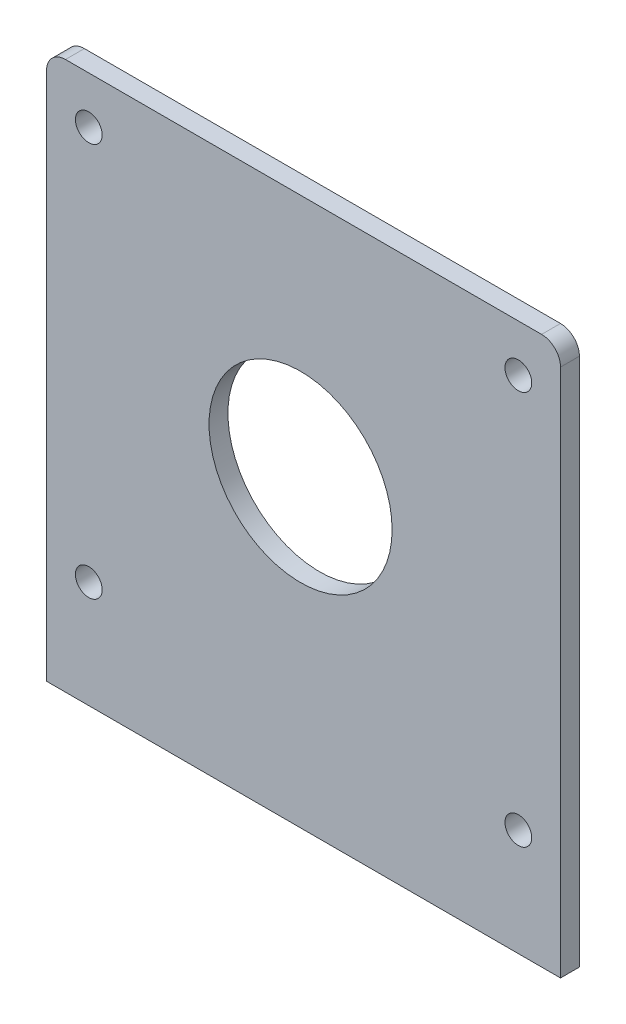
from build123d import *

# Parameters (mm, degrees)
SKETCH2_W            = 86.36
SKETCH2_H            = 85.725
BOSS_EXTRUDE1_DEPTH  = 1.5875
SKETCH3_R            = 15.380999972
CUT_EXTRUDE1_DEPTH   = 61.924436241
M4_CLEARANCE_HOLE1_D = 4.5
SKETCH5_W            = 86.36
SKETCH5_H            = 6.35
BOSS_EXTRUDE2_DEPTH  = 3.175
FILLET1_R            = 3.175


with BuildPart() as part:
    # Sketch2 → Boss-Extrude1 (new, symmetric)
    with BuildSketch(Plane.XY):
        Rectangle(SKETCH2_W, SKETCH2_H)
    extrude(amount=BOSS_EXTRUDE1_DEPTH, both=True)

    # Sketch3 → Cut-Extrude1 (cut, through all)
    with BuildSketch(Plane.XY.offset(1.5875)):
        with Locations((-0.5, 1.8625)):
            Circle(SKETCH3_R)
    extrude(amount=-CUT_EXTRUDE1_DEPTH, mode=Mode.SUBTRACT)

    # M4 Clearance Hole1 (through all)
    with Locations(Plane(origin=(36.09137025, 34.95387025, 1.5875), x_dir=(1, 0, 0), z_dir=(0, 0, 1))):
        with Locations((0, 0), (0, -66.1827405), (-72.1827405, 0), (-72.1827405, -66.1827405)):
            Hole(M4_CLEARANCE_HOLE1_D / 2)

    # Sketch5 → Boss-Extrude2 (add)
    with BuildSketch(Plane.XY.offset(1.5875)):
        with Locations((0, -46.0375)):
            Rectangle(SKETCH5_W, SKETCH5_H)
    extrude(amount=-BOSS_EXTRUDE2_DEPTH)

    # Fillet1
    fillet1_edges = [part.edges().sort_by_distance(p)[0] for p in [
        (-43.18, 42.8625, 0),
        (43.18, 42.8625, 0),
    ]]
    fillet(fillet1_edges, radius=FILLET1_R)


solid = part.part
